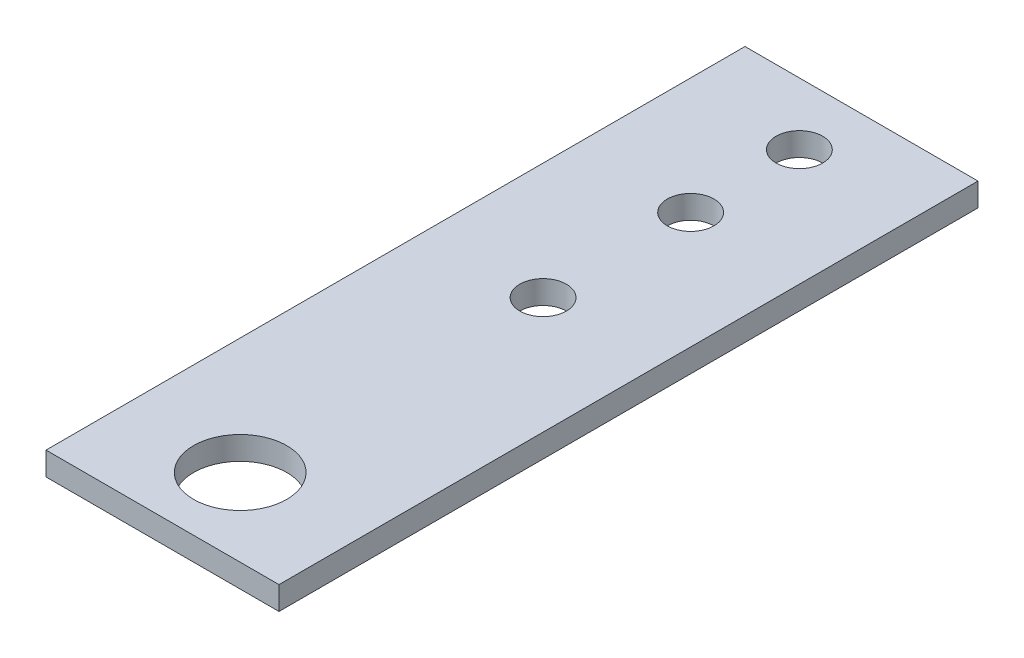
from build123d import *

# Parameters (mm, degrees)
ESQUISSE1_W      = 15
ESQUISSE1_H      = 1.5
EXTRUSION1_DEPTH = 45
ESQUISSE2_R      = 1.5
ESQUISSE2_R_2    = 3
EXTRUSION2_DEPTH = 50


with BuildPart() as part:
    # Esquisse1 → Extrusion1 (new body)
    with BuildSketch(Plane.XY):
        with Locations((-1.409317959, 2.431684211)):
            Rectangle(ESQUISSE1_W, ESQUISSE1_H)
    extrude(amount=EXTRUSION1_DEPTH)

    # Esquisse2 → Extrusion2 (cut)
    with BuildSketch(Plane(origin=(0, 3.181684211, 0), x_dir=(-1, 0, 0), z_dir=(0, 1, 0))):
        with Locations(Location((1.409317959, 4, 0), (0, 0, 90))):
            Circle(ESQUISSE2_R)
        with Locations(Location((1.409317959, 11, 0), (0, 0, 90))):
            Circle(ESQUISSE2_R)
        with Locations(Location((1.409317959, 20.5, 0), (0, 0, 90))):
            Circle(ESQUISSE2_R)
        with Locations(Location((1.409317959, 40, 0), (0, 0, 90))):
            Circle(ESQUISSE2_R_2)
    extrude(amount=-EXTRUSION2_DEPTH, mode=Mode.SUBTRACT)


solid = part.part
